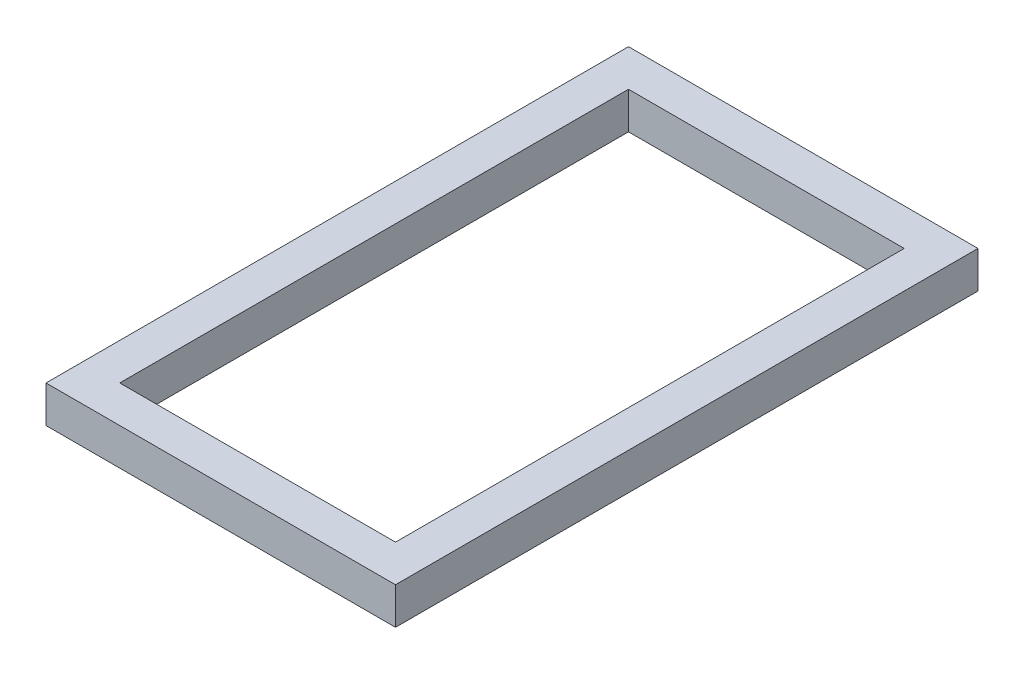
from build123d import *

# Parameters (mm, degrees)
SKETCH1_W           = 180
SKETCH1_H           = 300
SKETCH1_W_2         = 142
SKETCH1_H_2         = 262
BOSS_EXTRUDE1_DEPTH = 19


with BuildPart() as part:
    # Sketch1 → Boss-Extrude1 (new body)
    with BuildSketch(Plane(origin=(0, 0, 0), x_dir=(1, 0, 0), z_dir=(0, 1, 0))):
        Rectangle(SKETCH1_W, SKETCH1_H)
        Rectangle(SKETCH1_W_2, SKETCH1_H_2, mode=Mode.SUBTRACT)
    extrude(amount=BOSS_EXTRUDE1_DEPTH)


solid = part.part
